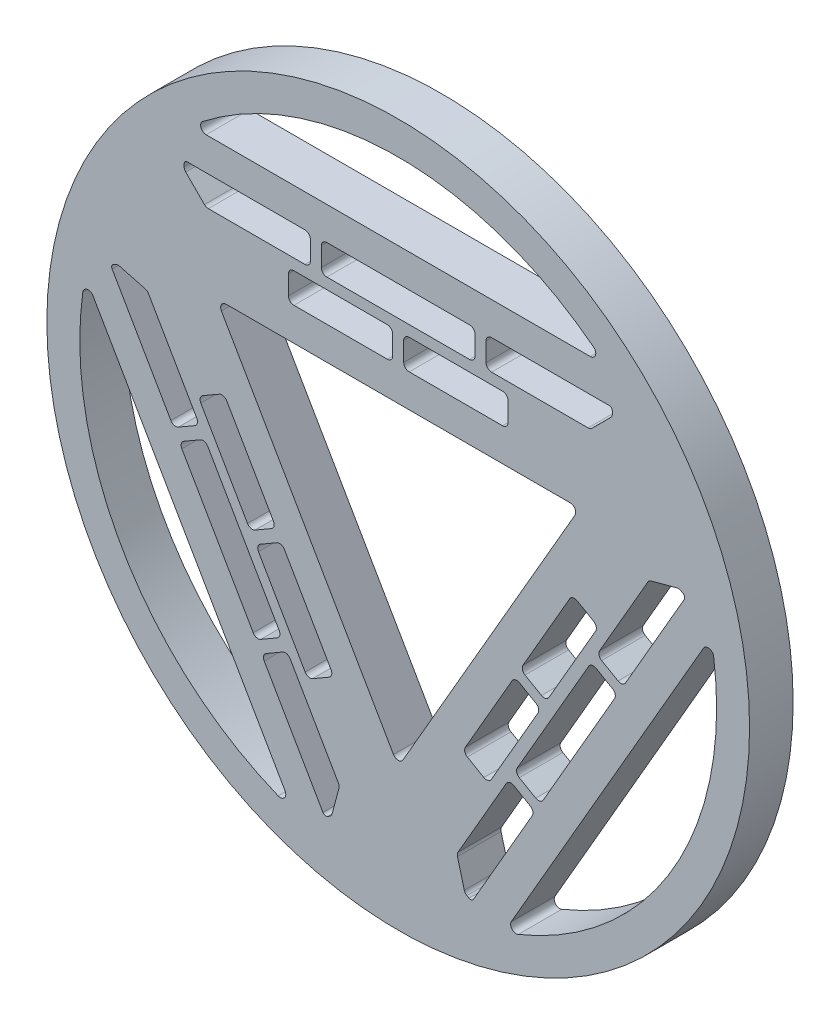
from build123d import *

# Parameters (mm, degrees)
SKETCH2_W           = 5.75
SKETCH2_H           = 1.363248654
SKETCH2_W_2         = 7
BOSS_EXTRUDE1_DEPTH = 1.984375
FILLET1_R           = 0.25
FILLET2_R           = 0.25
CHAMFER1_SIZE       = 1
FILLET3_R           = 0.15
FILLET4_R           = 0.25
FILLET5_R           = 0.25
FILLET6_R           = 0.25


with BuildPart() as part:
    # Sketch2 → Boss-Extrude1 (new body)
    with BuildSketch(Plane.XY):
        with BuildLine():
            ThreePointArc((-12.87439319, 9.5), (-13.856406461, 8), (-14.664437931, 6.39955156))
            ThreePointArc((-14.664437931, 6.39955156), (-3.268714817, -15.662550988), (16, 0))
            ThreePointArc((16, 0), (5.000485425, 15.198524452), (-12.87439319, 9.5))
        make_face()
        Polygon((-5.04663337, -7.532477288), (-2.17163337, -12.51212336), (-3.352241336, -13.193747687), (-6.227241336, -8.214101615), align=None, mode=Mode.SUBTRACT)
        with BuildLine():
            Line((-14.249890349, 2.681534086), (-4.802668535, -13.681534086))
            ThreePointArc((-4.802668535, -13.681534086), (-12.557368355, -7.25), (-14.249890349, 2.681534086))
        make_face(mode=Mode.SUBTRACT)
        Polygon((-6.477241336, -7.781088913), (-9.977241336, -1.718911087), (-8.79663337, -1.03728676), (-5.29663337, -7.099464586), align=None, mode=Mode.SUBTRACT)
        Polygon((-5.308012702, -3.353257697), (-2.933012702, -7.466878365), (-4.113620668, -8.148502692), (-4.863620668, -6.849464586), (-6.488620668, -4.034882024), align=None, mode=Mode.SUBTRACT)
        Polygon((-7.933012702, 1.193375673), (-5.558012702, -2.920244995), (-6.738620668, -3.601869322), (-8.363620668, -0.78728676), (-9.113620668, 0.511751346), align=None, mode=Mode.SUBTRACT)
        Polygon((8.267949192, 4.773502692), (0, -9.547005384), (-8.267949192, 4.773502692), align=None, mode=Mode.SUBTRACT)
        Polygon((3.352241336, -13.193747687), (2.17163337, -12.51212336), (5.04663337, -7.532477288), (6.227241336, -8.214101615), align=None, mode=Mode.SUBTRACT)
        Polygon((4.863620668, -6.849464586), (4.113620668, -8.148502692), (2.933012702, -7.466878365), (5.308012702, -3.353257697), (6.488620668, -4.034882024), align=None, mode=Mode.SUBTRACT)
        Polygon((8.79663337, -1.03728676), (9.977241336, -1.718911087), (6.477241336, -7.781088913), (5.29663337, -7.099464586), align=None, mode=Mode.SUBTRACT)
        Polygon((5.558012702, -2.920244995), (7.933012702, 1.193375673), (9.113620668, 0.511751346), (8.363620668, -0.78728676), (6.738620668, -3.601869322), align=None, mode=Mode.SUBTRACT)
        with BuildLine():
            Line((4.802668535, -13.681534086), (14.249890349, 2.681534086))
            ThreePointArc((14.249890349, 2.681534086), (12.557368355, -7.25), (4.802668535, -13.681534086))
        make_face(mode=Mode.SUBTRACT)
        Polygon((-9.04663337, -0.604274058), (-10.227241336, -1.285898385), (-13.102241336, 3.693747687), (-11.92163337, 4.375372014), align=None, mode=Mode.SUBTRACT)
        Polygon((-0.25, 6.273502692), (-5, 6.273502692), (-5, 7.636751346), (-3.5, 7.636751346), (-0.25, 7.636751346), align=None, mode=Mode.SUBTRACT)
        with Locations((-6.875, 8.818375673)):
            Rectangle(SKETCH2_W, SKETCH2_H, mode=Mode.SUBTRACT)
        Polygon((5, 6.273502692), (0.25, 6.273502692), (0.25, 7.636751346), (3.5, 7.636751346), (5, 7.636751346), align=None, mode=Mode.SUBTRACT)
        Polygon((11.92163337, 4.375372014), (13.102241336, 3.693747687), (10.227241336, -1.285898385), (9.04663337, -0.604274058), align=None, mode=Mode.SUBTRACT)
        with Locations((0, 8.818375673)):
            Rectangle(SKETCH2_W_2, SKETCH2_H, mode=Mode.SUBTRACT)
        with Locations((6.875, 8.818375673)):
            Rectangle(SKETCH2_W, SKETCH2_H, mode=Mode.SUBTRACT)
        with BuildLine():
            Line((9.447221814, 11), (-9.447221814, 11))
            ThreePointArc((-9.447221814, 11), (0, 14.5), (9.447221814, 11))
        make_face(mode=Mode.SUBTRACT)
    extrude(amount=BOSS_EXTRUDE1_DEPTH)

    # Fillet1
    fillet1_edges = [part.edges().sort_by_distance(p)[0] for p in [
        (-4.802668535, -13.681534086, 0.9921875),
        (-14.249890349, 2.681534086, 0.9921875),
        (-9.447221814, 11, 0.9921875),
        (9.447221814, 11, 0.9921875),
        (14.249890349, 2.681534086, 0.9921875),
        (4.802668535, -13.681534086, 0.9921875),
    ]]
    fillet(fillet1_edges, radius=FILLET1_R)

    # Fillet2
    fillet2_edges = [part.edges().sort_by_distance(p)[0] for p in [
        (-8.267949192, 4.773502692, 0.9921875),
        (0, -9.547005384, 0.9921875),
        (8.267949192, 4.773502692, 0.9921875),
    ]]
    fillet(fillet2_edges, radius=FILLET2_R)

    # Chamfer1
    chamfer1_edges = [part.edges().sort_by_distance(p)[0] for p in [
        (-11.92163337, 4.375372014, 0.9921875),
        (-2.17163337, -12.51212336, 0.9921875),
        (9.75, 8.136751346, 0.9921875),
        (11.92163337, 4.375372014, 0.9921875),
        (2.17163337, -12.51212336, 0.9921875),
        (-9.75, 8.136751346, 0.9921875),
    ]]
    chamfer(chamfer1_edges, length=CHAMFER1_SIZE)

    # Fillet3
    fillet3_edges = [part.edges().sort_by_distance(p)[0] for p in [
        (-13.102241336, 3.693747687, 0.9921875),
        (-3.352241336, -13.193747687, 0.9921875),
        (9.75, 9.5, 0.9921875),
        (13.102241336, 3.693747687, 0.9921875),
        (3.352241336, -13.193747687, 0.9921875),
        (-9.75, 9.5, 0.9921875),
    ]]
    fillet(fillet3_edges, radius=FILLET3_R)

    # Fillet4
    fillet4_edges = [part.edges().sort_by_distance(p)[0] for p in [
        (-3.5, 8.136751346, 0.9921875),
        (3.5, 8.136751346, 0.9921875),
        (3.5, 9.5, 0.9921875),
        (-3.5, 9.5, 0.9921875),
        (4, 8.136751346, 0.9921875),
        (4, 9.5, 0.9921875),
        (-5, 7.636751346, 0.9921875),
        (-5, 6.273502692, 0.9921875),
        (-0.25, 6.273502692, 0.9921875),
        (-0.25, 7.636751346, 0.9921875),
        (0.25, 6.273502692, 0.9921875),
        (5, 6.273502692, 0.9921875),
        (5, 7.636751346, 0.9921875),
        (0.25, 7.636751346, 0.9921875),
        (-4, 8.136751346, 0.9921875),
        (-4, 9.5, 0.9921875),
        (-9.75, 9.136751346, 0.9921875),
        (-8.75, 8.136751346, 0.9921875),
        (8.75, 8.136751346, 0.9921875),
        (9.75, 9.136751346, 0.9921875),
    ]]
    fillet(fillet4_edges, radius=FILLET4_R)

    # Fillet5
    fillet5_edges = [part.edges().sort_by_distance(p)[0] for p in [
        (5.308012702, -3.353257697, 0.9921875),
        (2.933012702, -7.466878365, 0.9921875),
        (4.113620668, -8.148502692, 0.9921875),
        (6.488620668, -4.034882024, 0.9921875),
        (10.227241336, -1.285898385, 0.9921875),
        (9.04663337, -0.604274058, 0.9921875),
        (6.738620668, -3.601869322, 0.9921875),
        (9.113620668, 0.511751346, 0.9921875),
        (7.933012702, 1.193375673, 0.9921875),
        (5.558012702, -2.920244995, 0.9921875),
        (5.04663337, -7.532477288, 0.9921875),
        (6.227241336, -8.214101615, 0.9921875),
        (8.79663337, -1.03728676, 0.9921875),
        (5.29663337, -7.099464586, 0.9921875),
        (6.477241336, -7.781088913, 0.9921875),
        (9.977241336, -1.718911087, 0.9921875),
        (12.787658774, 3.875372014, 0.9921875),
        (11.42163337, 3.50934661, 0.9921875),
        (2.67163337, -11.646097956, 0.9921875),
        (3.037658774, -13.01212336, 0.9921875),
    ]]
    fillet(fillet5_edges, radius=FILLET5_R)

    # Fillet6
    fillet6_edges = [part.edges().sort_by_distance(p)[0] for p in [
        (-10.227241336, -1.285898385, 0.9921875),
        (-9.04663337, -0.604274058, 0.9921875),
        (-5.04663337, -7.532477288, 0.9921875),
        (-6.227241336, -8.214101615, 0.9921875),
        (-5.558012702, -2.920244995, 0.9921875),
        (-7.933012702, 1.193375673, 0.9921875),
        (-9.113620668, 0.511751346, 0.9921875),
        (-6.738620668, -3.601869322, 0.9921875),
        (-4.113620668, -8.148502692, 0.9921875),
        (-2.933012702, -7.466878365, 0.9921875),
        (-5.308012702, -3.353257697, 0.9921875),
        (-6.488620668, -4.034882024, 0.9921875),
        (-5.29663337, -7.099464586, 0.9921875),
        (-8.79663337, -1.03728676, 0.9921875),
        (-9.977241336, -1.718911087, 0.9921875),
        (-6.477241336, -7.781088913, 0.9921875),
        (-3.037658774, -13.01212336, 0.9921875),
        (-2.67163337, -11.646097956, 0.9921875),
        (-11.42163337, 3.50934661, 0.9921875),
        (-12.787658774, 3.875372014, 0.9921875),
    ]]
    fillet(fillet6_edges, radius=FILLET6_R)


solid = part.part
